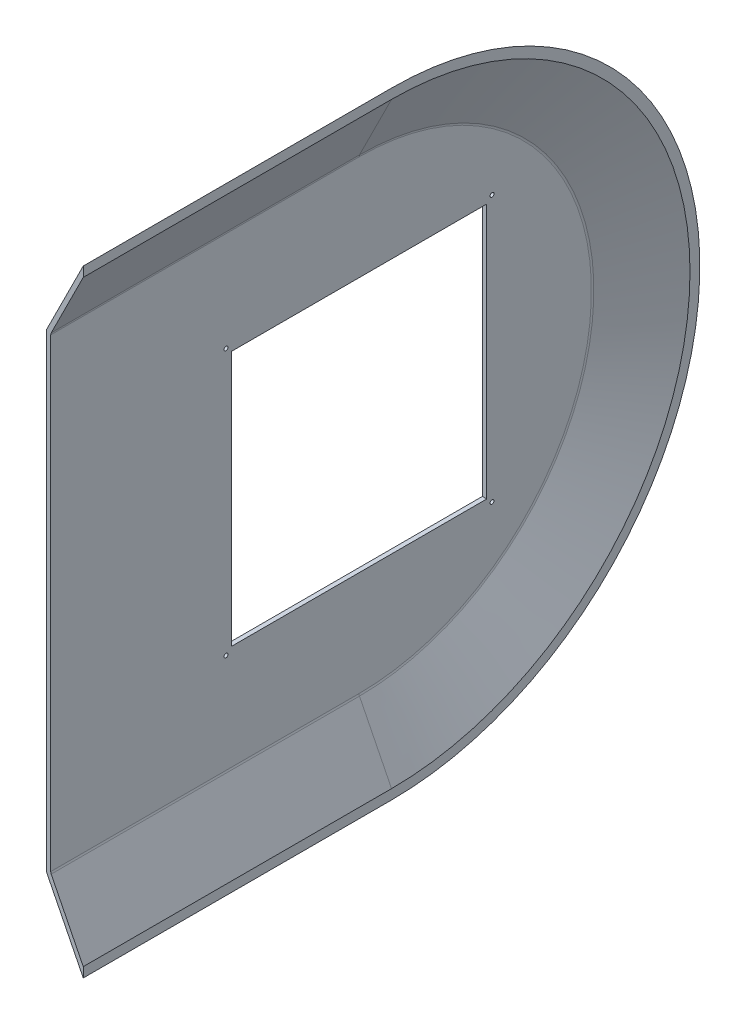
from build123d import *

# Parameters (mm, degrees)
REVOLVE1_ANGLE           = 180
BOSS_EXTRUDE1_DEPTH      = 350
SHELL2_T                 = -5
SKETCH4_W                = 290
SKETCH4_H                = 290
CUT_EXTRUDE1_DEPTH       = 497.747272869
M4_CLEARANCE_HOLE1_D     = 4.5
M4_CLEARANCE_HOLE1_DEPTH = 30
M4_CLEARANCE_HOLE1_TIP   = 1.351936393
FILLET1_R                = 5


with BuildPart() as part:
    # Esquisse2 → Revolve1 (revolve)
    with BuildSketch(Plane.XY):
        Polygon((41.926758797, 350), (41.926758797, 0), (0, 0), (0, 266.190547052), align=None)
    revolve(axis=Axis((41.926758797, 0, 0), (-1, 0, 0)), revolution_arc=REVOLVE1_ANGLE)

    # Sketch5 → Boss-Extrude1 (add)
    with BuildSketch(Plane.XY):
        Polygon((0, 266.190547052), (41.926758797, 350), (41.926758797, -350), (0, -266.190547052), align=None)
    extrude(amount=BOSS_EXTRUDE1_DEPTH)

    # Shell2
    shell2_openings = [part.faces().sort_by_distance(p)[0] for p in [
        (21.913804754, 0, 350),
        (41.926758797, 0, 32.672450622),
    ]]
    offset(amount=SHELL2_T, openings=shell2_openings, kind=Kind.INTERSECTION)

    # Sketch4 → Cut-Extrude1 (cut, through all)
    with BuildSketch(Plane.ZY):
        Rectangle(SKETCH4_W, SKETCH4_H)
    extrude(amount=-CUT_EXTRUDE1_DEPTH, mode=Mode.SUBTRACT)

    # M4 Clearance Hole1
    with Locations(Plane.ZY):
        with Locations((151, 151), (151, -151), (-151, -151), (-151, 151)):
            Hole(M4_CLEARANCE_HOLE1_D / 2, depth=M4_CLEARANCE_HOLE1_DEPTH)
            with Locations((0, 0, -(M4_CLEARANCE_HOLE1_DEPTH + M4_CLEARANCE_HOLE1_TIP / 2))):  # 118° drill point
                Cone(0, M4_CLEARANCE_HOLE1_D / 2, M4_CLEARANCE_HOLE1_TIP, mode=Mode.SUBTRACT)

    # Fillet1
    fillet1_edges = [part.edges().sort_by_distance(p)[0] for p in [
        (0, 266.190547052, 175),
        (0, -266.190547052, 175),
        (5, 0, -265.009652137),
        (5, 265.009652137, 175),
        (5, -265.009652137, 175),
        (0, 0, -266.190547052),
    ]]
    fillet(fillet1_edges, radius=FILLET1_R)


solid = part.part
